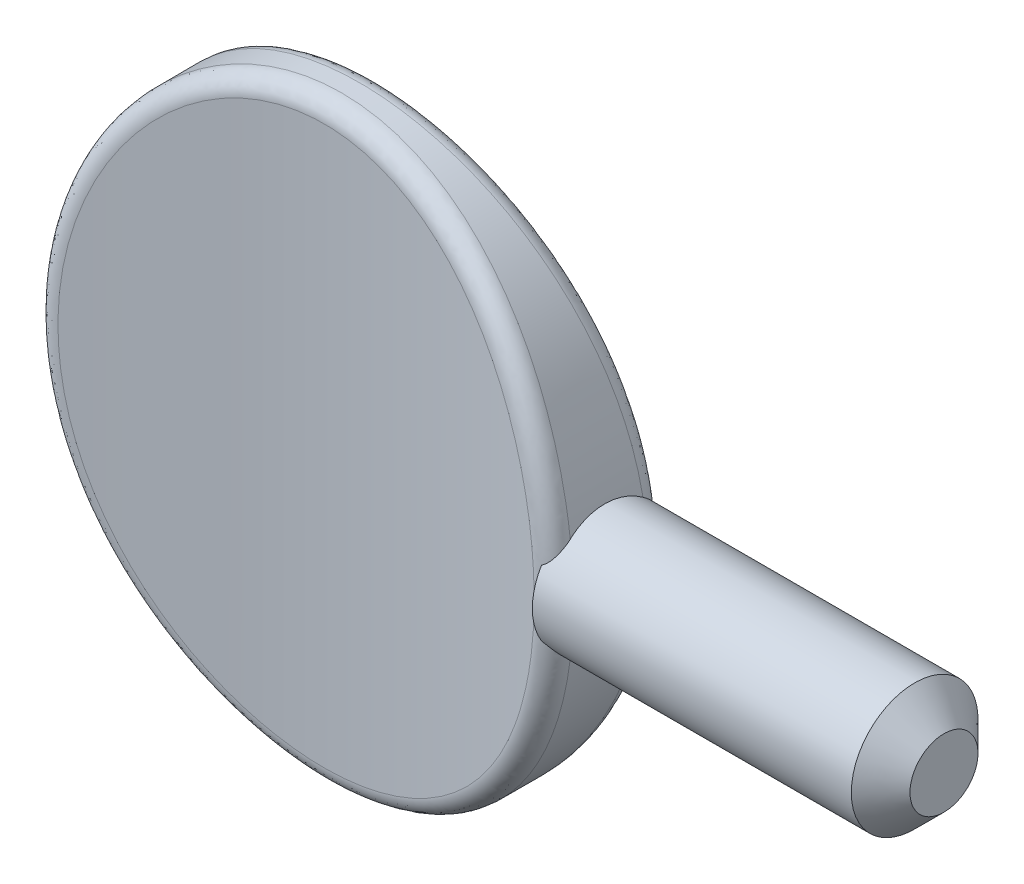
from build123d import *

# Parameters (mm, degrees)
SKETCH1_RX              = 11.303
SKETCH1_RY              = 9.906
EXTRUDE1_DEPTH          = 2.286
CUT_EXTRUDE1_DEPTH      = 16.202382741
CUT_EXTRUDE1_DEPTH_BACK = 16.202382741
SKETCH2_OUTSIDE_W       = 27.892
SKETCH2_OUTSIDE_H       = 12.652
FILLET3_R               = 0.677333333


with BuildPart() as part:
    # Sketch1 → Extrude1 (new, symmetric)
    with BuildSketch(Plane.XY):
        with Locations(Location((0, 0), (0, 0, -90))):
            Ellipse(SKETCH1_RX, SKETCH1_RY)
    extrude(amount=EXTRUDE1_DEPTH, both=True)

    # Sketch2 outside → Cut-Extrude1 (cut, two sides: drawn at the far end of the back side and taken through both)
    with BuildSketch(Plane(origin=(0, 0, 0), x_dir=(1, 0, 0), z_dir=(0, 1, 0)).offset(-CUT_EXTRUDE1_DEPTH_BACK)):
        Rectangle(SKETCH2_OUTSIDE_W, SKETCH2_OUTSIDE_H)
        with BuildLine():
            Line((-9.906, 2.286), (-9.906, -2.286))
            ThreePointArc((-9.906, -2.286), (0, -1.016), (9.906, -2.286))
            Line((9.906, -2.286), (9.906, 2.286))
            ThreePointArc((9.906, 2.286), (0, 1.016), (-9.906, 2.286))
        make_face(mode=Mode.SUBTRACT)
    extrude(amount=CUT_EXTRUDE1_DEPTH + CUT_EXTRUDE1_DEPTH_BACK, mode=Mode.SUBTRACT)

    # Fillet3
    fillet3_edges = [part.edges().sort_by_distance(p)[0] for p in [
        (-7.228513924, -7.728494619, 1.687044844),
        (3.75e-07, 11.303, -1.016),
    ]]
    fillet(fillet3_edges, radius=FILLET3_R)

    # Sketch3 → Revolve1 (revolve)
    with BuildSketch(Plane(origin=(0, 0, 0), x_dir=(1, 0, 0), z_dir=(0, 1, 0))):
        with BuildLine():
            Line((22.606, 0), (22.606, 1.2954))
            Line((22.606, 1.2954), (21.4884, 2.413))
            Line((21.4884, 2.413), (13.208, 2.413))
            Line((13.208, 2.413), (9.336678517, 2.413))
            ThreePointArc((9.336678517, 2.413), (9.262571156, 2.199720149), (9.072182281, 2.078343579))
            Line((9.072182281, 2.078343579), (9.072182281, 0))
            Line((9.072182281, 0), (22.606, 0))
        make_face()
    revolve(axis=Axis((0, 0, 0), (1, 0, 0)))


solid = part.part
